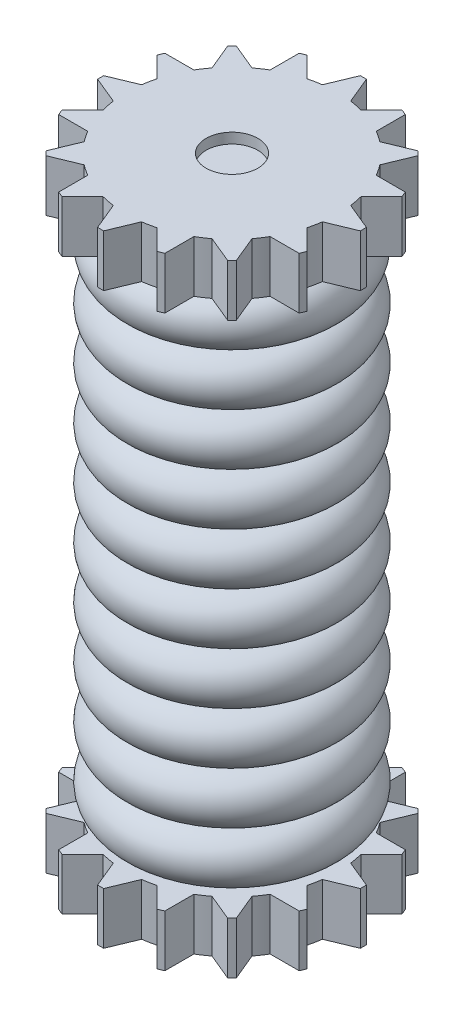
from build123d import *

# Parameters (mm, degrees)
SKETCH6_W           = 100
SKETCH6_H           = 16.625
BOSS_EXTRUDE3_DEPTH = 10
SKETCH4_R           = 5
BOSS_EXTRUDE4_DEPTH = 10
SKETCH7_R           = 5
CUT_EXTRUDE1_DEPTH  = 2


with BuildPart() as part:
    # Sketch6 → Revolve1 (revolve)
    with BuildSketch(Plane(origin=(0, 0, 0), x_dir=(0, 1, 0), z_dir=(0, 0, 1)), mode=Mode.PRIVATE) as revolve1_sk:
        with Locations((50, -8.3125)):
            Rectangle(SKETCH6_W, SKETCH6_H)
        with BuildLine():
            Line((10, -16.625), (0, -16.625))
            ThreePointArc((0, -16.625), (5, -21.625), (10, -16.625))
        make_face()
        with BuildLine():
            Line((20, -16.625), (10, -16.625))
            ThreePointArc((10, -16.625), (15, -21.625), (20, -16.625))
        make_face()
        with BuildLine():
            Line((30, -16.625), (20, -16.625))
            ThreePointArc((20, -16.625), (25, -21.625), (30, -16.625))
        make_face()
        with BuildLine():
            Line((40, -16.625), (30, -16.625))
            ThreePointArc((30, -16.625), (35, -21.625), (40, -16.625))
        make_face()
        with BuildLine():
            Line((50, -16.625), (40, -16.625))
            ThreePointArc((40, -16.625), (45, -21.625), (50, -16.625))
        make_face()
        with BuildLine():
            ThreePointArc((50, -16.625), (55, -21.625), (60, -16.625))
            Line((60, -16.625), (50, -16.625))
        make_face()
        with BuildLine():
            ThreePointArc((60, -16.625), (65, -21.625), (70, -16.625))
            Line((70, -16.625), (60, -16.625))
        make_face()
        with BuildLine():
            ThreePointArc((70, -16.625), (75, -21.625), (80, -16.625))
            Line((80, -16.625), (70, -16.625))
        make_face()
        with BuildLine():
            ThreePointArc((80, -16.625), (85, -21.625), (90, -16.625))
            Line((90, -16.625), (80, -16.625))
        make_face()
        with BuildLine():
            ThreePointArc((90, -16.625), (95, -21.625), (100, -16.625))
            Line((100, -16.625), (90, -16.625))
        make_face()
    revolve(revolve1_sk.sketch.rotate(Axis((0, 0, 0), (0, 1, 0)), 90), axis=Axis((0, 0, 0), (0, 1, 0)))

    # Sketch3 → Boss-Extrude3 (add)
    with BuildSketch(Plane.XZ):
        with BuildLine():
            Line((-2.733, 20.190872591), (-0.588491123, 25.368175007))
            ThreePointArc((-0.588491123, 25.368175007), (0, 25.375), (0.588491123, 25.368175007))
            Line((0.588491123, 25.368175007), (2.733, 20.190872591))
            ThreePointArc((2.733, 20.190872591), (3.974965311, 19.983500088), (5.201749663, 19.699807751))
            Line((5.201749663, 19.699807751), (9.164285381, 23.662343469))
            ThreePointArc((9.164285381, 23.662343469), (9.710592096, 23.443443137), (10.251675188, 23.211931864))
            Line((10.251675188, 23.211931864), (10.251675188, 17.60806011))
            ThreePointArc((10.251675188, 17.60806011), (11.319743498, 16.941193351), (12.344580094, 16.20962576))
            Line((12.344580094, 16.20962576), (17.52188251, 18.354134638))
            ThreePointArc((17.52188251, 18.354134638), (17.942834573, 17.942834573), (18.354134638, 17.52188251))
            Line((18.354134638, 17.52188251), (16.20962576, 12.344580094))
            ThreePointArc((16.20962576, 12.344580094), (16.941193351, 11.319743498), (17.60806011, 10.251675188))
            Line((17.60806011, 10.251675188), (23.211931864, 10.251675188))
            ThreePointArc((23.211931864, 10.251675188), (23.443443137, 9.710592096), (23.662343469, 9.164285381))
            Line((23.662343469, 9.164285381), (19.699807751, 5.201749663))
            ThreePointArc((19.699807751, 5.201749663), (19.983500088, 3.974965311), (20.190872591, 2.733))
            Line((20.190872591, 2.733), (25.368175007, 0.588491123))
            ThreePointArc((25.368175007, 0.588491123), (25.375, 0), (25.368175007, -0.588491123))
            Line((25.368175007, -0.588491123), (20.190872591, -2.733))
            ThreePointArc((20.190872591, -2.733), (19.983500088, -3.974965311), (19.699807751, -5.201749663))
            Line((19.699807751, -5.201749663), (23.662343469, -9.164285381))
            ThreePointArc((23.662343469, -9.164285381), (23.443443137, -9.710592096), (23.211931864, -10.251675188))
            Line((23.211931864, -10.251675188), (17.60806011, -10.251675188))
            ThreePointArc((17.60806011, -10.251675188), (16.941193351, -11.319743498), (16.20962576, -12.344580094))
            Line((16.20962576, -12.344580094), (18.354134638, -17.52188251))
            ThreePointArc((18.354134638, -17.52188251), (17.942834573, -17.942834573), (17.52188251, -18.354134638))
            Line((17.52188251, -18.354134638), (12.344580094, -16.20962576))
            ThreePointArc((12.344580094, -16.20962576), (11.319743498, -16.941193351), (10.251675188, -17.60806011))
            Line((10.251675188, -17.60806011), (10.251675188, -23.211931864))
            ThreePointArc((10.251675188, -23.211931864), (9.710592096, -23.443443137), (9.164285381, -23.662343469))
            Line((9.164285381, -23.662343469), (5.201749663, -19.699807751))
            ThreePointArc((5.201749663, -19.699807751), (3.974965311, -19.983500088), (2.733, -20.190872591))
            Line((2.733, -20.190872591), (0.588491123, -25.368175007))
            ThreePointArc((0.588491123, -25.368175007), (0, -25.375), (-0.588491123, -25.368175007))
            Line((-0.588491123, -25.368175007), (-2.733, -20.190872591))
            ThreePointArc((-2.733, -20.190872591), (-3.974965311, -19.983500088), (-5.201749663, -19.699807751))
            Line((-5.201749663, -19.699807751), (-9.164285381, -23.662343469))
            ThreePointArc((-9.164285381, -23.662343469), (-9.710592096, -23.443443137), (-10.251675188, -23.211931864))
            Line((-10.251675188, -23.211931864), (-10.251675188, -17.60806011))
            ThreePointArc((-10.251675188, -17.60806011), (-11.319743498, -16.941193351), (-12.344580094, -16.20962576))
            Line((-12.344580094, -16.20962576), (-17.52188251, -18.354134638))
            ThreePointArc((-17.52188251, -18.354134638), (-17.942834573, -17.942834573), (-18.354134638, -17.52188251))
            Line((-18.354134638, -17.52188251), (-16.20962576, -12.344580094))
            ThreePointArc((-16.20962576, -12.344580094), (-16.941193351, -11.319743498), (-17.60806011, -10.251675188))
            Line((-17.60806011, -10.251675188), (-23.211931864, -10.251675188))
            ThreePointArc((-23.211931864, -10.251675188), (-23.443443137, -9.710592096), (-23.662343469, -9.164285381))
            Line((-23.662343469, -9.164285381), (-19.699807751, -5.201749663))
            ThreePointArc((-19.699807751, -5.201749663), (-19.983500088, -3.974965311), (-20.190872591, -2.733))
            Line((-20.190872591, -2.733), (-25.368175007, -0.588491123))
            ThreePointArc((-25.368175007, -0.588491123), (-25.375, 0), (-25.368175007, 0.588491123))
            Line((-25.368175007, 0.588491123), (-20.190872591, 2.733))
            ThreePointArc((-20.190872591, 2.733), (-19.983500088, 3.974965311), (-19.699807751, 5.201749663))
            Line((-19.699807751, 5.201749663), (-23.662343469, 9.164285381))
            ThreePointArc((-23.662343469, 9.164285381), (-23.443443137, 9.710592096), (-23.211931864, 10.251675188))
            Line((-23.211931864, 10.251675188), (-17.60806011, 10.251675188))
            ThreePointArc((-17.60806011, 10.251675188), (-16.941193351, 11.319743498), (-16.20962576, 12.344580094))
            Line((-16.20962576, 12.344580094), (-18.354134638, 17.52188251))
            ThreePointArc((-18.354134638, 17.52188251), (-17.942834573, 17.942834573), (-17.52188251, 18.354134638))
            Line((-17.52188251, 18.354134638), (-12.344580094, 16.20962576))
            ThreePointArc((-12.344580094, 16.20962576), (-11.319743498, 16.941193351), (-10.251675188, 17.60806011))
            Line((-10.251675188, 17.60806011), (-10.251675188, 23.211931864))
            ThreePointArc((-10.251675188, 23.211931864), (-9.710592096, 23.443443137), (-9.164285381, 23.662343469))
            Line((-9.164285381, 23.662343469), (-5.201749663, 19.699807751))
            ThreePointArc((-5.201749663, 19.699807751), (-3.974965311, 19.983500088), (-2.733, 20.190872591))
        make_face()
    boss_extrude3 = extrude(amount=BOSS_EXTRUDE3_DEPTH)

    # Mirror1: Boss-Extrude3 across plane
    add(boss_extrude3.mirror(Plane.ZX.offset(50)))

    # Sketch4 → Boss-Extrude4 (add)
    with BuildSketch(Plane.XZ.offset(10)):
        with Locations(Location((0, 0, 0), (0, 0, 270))):
            Circle(SKETCH4_R)
    extrude(amount=BOSS_EXTRUDE4_DEPTH)

    # Sketch7 → Cut-Extrude1 (cut)
    with BuildSketch(Plane(origin=(0, 110, 0), x_dir=(-1, 0, 0), z_dir=(0, 1, 0))):
        with Locations(Location((0, 0, 0), (0, 0, 270))):
            Circle(SKETCH7_R)
    extrude(amount=-CUT_EXTRUDE1_DEPTH, mode=Mode.SUBTRACT)


solid = part.part
